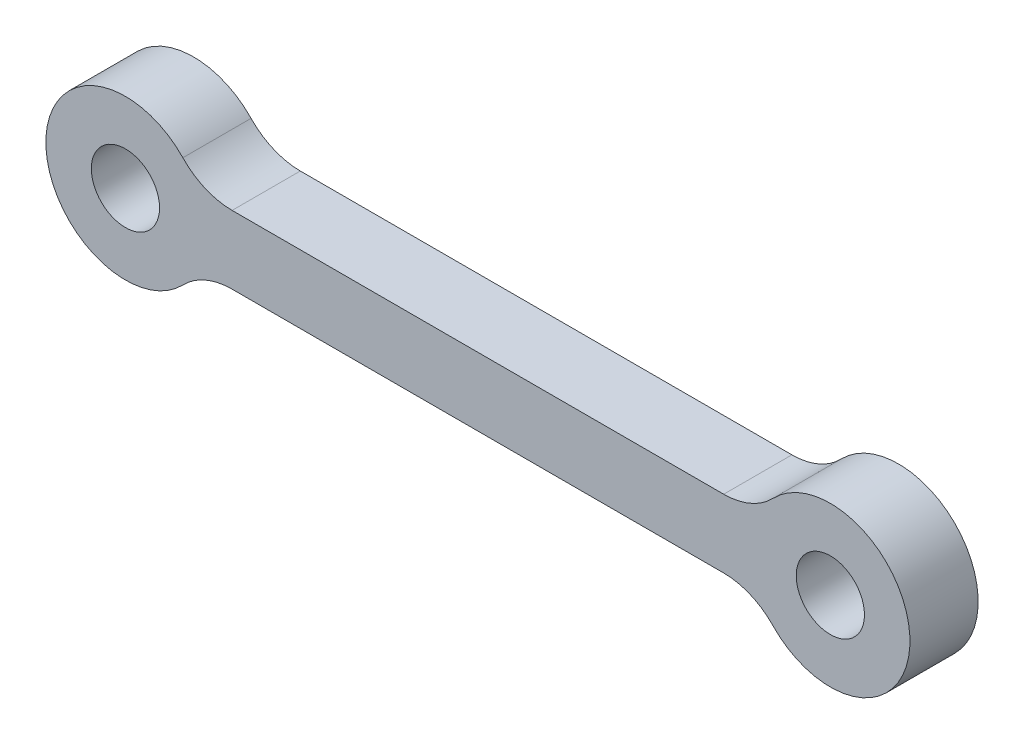
from build123d import *

# Parameters (mm, degrees)
SKETCH1_R           = 1.5
BOSS_EXTRUDE1_DEPTH = 3
FILLET1_R           = 3


with BuildPart() as part:
    # Sketch1 → Boss-Extrude1 (new body)
    with BuildSketch(Plane.XY):
        with BuildLine():
            Line((-12.33772234, -1.5), (12.33772234, -1.5))
            ThreePointArc((12.33772234, -1.5), (19, 0), (12.33772234, 1.5))
            Line((12.33772234, 1.5), (-12.33772234, 1.5))
            ThreePointArc((-12.33772234, 1.5), (-19, 0), (-12.33772234, -1.5))
        make_face()
        with Locations((-15.5, 0)):
            Circle(SKETCH1_R, mode=Mode.SUBTRACT)
        with BuildLine():
            ThreePointArc((17, 0), (16.560660172, -1.060660172), (15.5, -1.5))
            ThreePointArc((15.5, -1.5), (14.439339828, 1.060660172), (17, 0))
        make_face(mode=Mode.SUBTRACT)
    extrude(amount=BOSS_EXTRUDE1_DEPTH)

    # Fillet1
    fillet1_edges = [part.edges().sort_by_distance(p)[0] for p in [
        (-12.33772234, -1.5, 1.5),
        (-12.33772234, 1.5, 1.5),
        (12.33772234, 1.5, 1.5),
        (12.33772234, -1.5, 1.5),
    ]]
    fillet(fillet1_edges, radius=FILLET1_R)


solid = part.part
